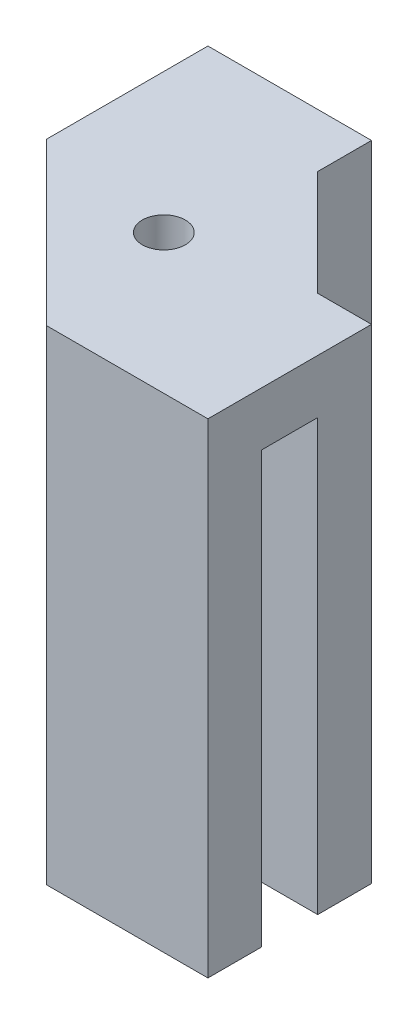
from build123d import *

# Parameters (mm, degrees)
BOSS_EXTRUDE1_DEPTH         = 50.8
TAP_DRILL_FOR_1_4_20_TAP1_D = 5.08
SKETCH4_R                   = 2.54
BOSS_EXTRUDE2_DEPTH         = 6.35


with BuildPart() as part:
    # Sketch1 → Boss-Extrude1 (new body)
    with BuildSketch(Plane(origin=(0, 0, 0), x_dir=(1, 0, 0), z_dir=(0, 1, 0))):
        Polygon((22.098, 9.652), (9.652, 22.098), (9.652, 28.448), (3.302, 28.448), (3.302, 15.748), (-3.302, 15.748), (-3.302, 28.448), (-9.652, 28.448), (-9.652, 9.398), (9.398, -9.652), (28.448, -9.652), (28.448, -3.302), (15.748, -3.302), (15.748, 3.302), (28.448, 3.302), (28.448, 9.652), align=None)
    extrude(amount=BOSS_EXTRUDE1_DEPTH)

    # Tap Drill for 1/4-20 Tap1 (through all)
    with Locations(Plane(origin=(0, 50.8, 0), x_dir=(1, 0, 0), z_dir=(0, 1, 0))):
        with Locations((6.795346667, 6.795346667)):
            Hole(TAP_DRILL_FOR_1_4_20_TAP1_D / 2)

    # Sketch4 → Boss-Extrude2 (add)
    with BuildSketch(Plane(origin=(0, 50.8, 0), x_dir=(1, 0, 0), z_dir=(0, 1, 0))):
        Polygon((-3.302, 28.448), (3.302, 28.448), (9.652, 28.448), (9.652, 22.098), (22.098, 9.652), (28.448, 9.652), (28.448, 3.302), (28.448, -3.302), (28.448, -9.652), (9.398, -9.652), (-9.652, 9.398), (-9.652, 28.448), align=None)
        with Locations(Location((6.795346667, 6.795346667, 0), (0, 0, 270))):
            Circle(SKETCH4_R, mode=Mode.SUBTRACT)
    extrude(amount=BOSS_EXTRUDE2_DEPTH)


solid = part.part
